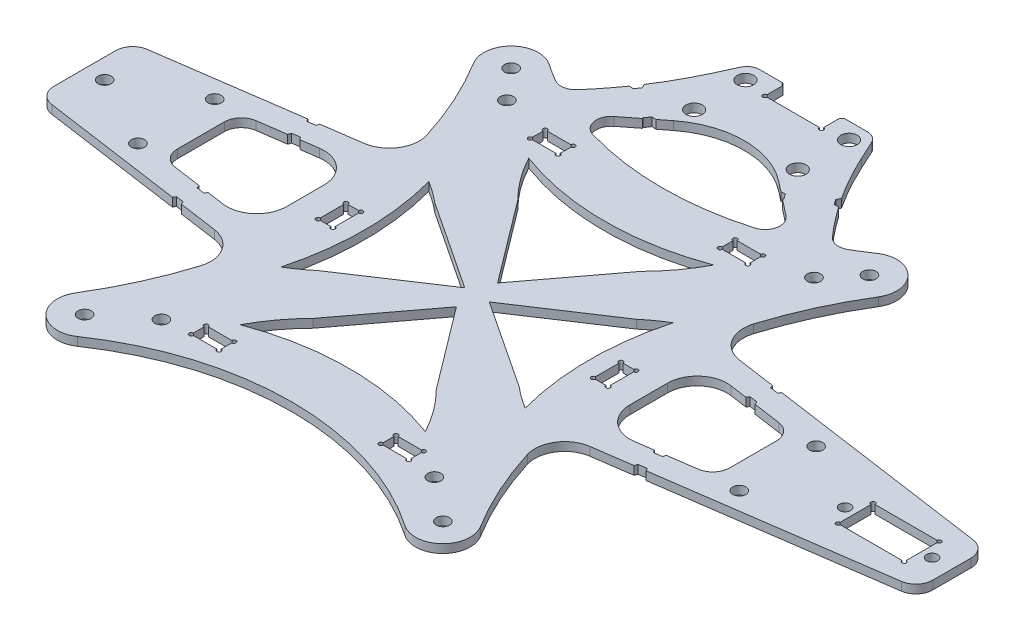
from build123d import *

# Parameters (mm, degrees)
SKETCH_1_R             = 1.55
SKETCH_1_R_2           = 1.3
SKETCH_1_W             = 6.5
SKETCH_1_H             = 3.5
SKETCH_1_W_2           = 3.5
SKETCH_1_H_2           = 6.5
SKETCH_1_W_3           = 15.5
SKETCH_1_H_3           = 8.2
EXTRUDE_1_DEPTH        = 2
FILLET_1_R             = 4
FILLET_2_R             = 7
SKETCH_4648_R          = 1.925
SKETCH_4648_R_2        = 1.55
EXTRUDE_2_DEPTH        = 2
CUT_EXTRUDE_7046_DEPTH = 137.476045095
SKETCH_10_R            = 0.5
CUT_EXTRUDE_7599_DEPTH = 137.476045095
FILLET_6_R             = 3.5


with BuildPart() as part:
    # 草图1 → 凸台-拉伸1 (new body)
    with BuildSketch(Plane(origin=(0, 0, 0), x_dir=(1, 0, 0), z_dir=(0, 1, 0))):
        with BuildLine():
            Line((111.35, 7.930343955), (111.35, -7.930343955))
            Line((111.35, -7.930343955), (36.25, -18.63611351))
            ThreePointArc((36.25, -18.63611351), (40.660213256, -33.120367866), (47.457481216, -46.649623332))
            ThreePointArc((47.457481216, -46.649623332), (46.417405741, -54.63634032), (38.389751701, -55.289161773))
            ThreePointArc((38.389751701, -55.289161773), (0, -43.436211003), (-38.389751701, -55.289161773))
            ThreePointArc((-38.389751701, -55.289161773), (-46.417405741, -54.63634032), (-47.457481216, -46.649623332))
            ThreePointArc((-47.457481216, -46.649623332), (-40.660213256, -33.120367866), (-36.25, -18.63611351))
            Line((-36.25, -18.63611351), (-91.953, -10.695454635))
            Line((-91.953, -10.695454635), (-91.953, 10.695454635))
            Line((-91.953, 10.695454635), (-36.25, 18.63611351))
            ThreePointArc((-36.25, 18.63611351), (-40.660213256, 33.120367866), (-47.457481216, 46.649623332))
            ThreePointArc((-47.457481216, 46.649623332), (-46.417405741, 54.63634032), (-38.389751701, 55.289161773))
            ThreePointArc((-38.389751701, 55.289161773), (0, 43.436211003), (38.389751701, 55.289161773))
            ThreePointArc((38.389751701, 55.289161773), (46.417405741, 54.63634032), (47.457481216, 46.649623332))
            ThreePointArc((47.457481216, 46.649623332), (40.660213256, 33.120367866), (36.25, 18.63611351))
            Line((36.25, 18.63611351), (111.35, 7.930343955))
        make_face()
        with Locations(Location((-36, 43, 0), (0, 0, 270))):
            Circle(SKETCH_1_R, mode=Mode.SUBTRACT)
        with Locations(Location((-32, -42, 0), (0, 0, 270))):
            Circle(SKETCH_1_R, mode=Mode.SUBTRACT)
        with Locations(Location((32, -42, 0), (0, 0, 90))):
            Circle(SKETCH_1_R, mode=Mode.SUBTRACT)
        with Locations(Location((36, 43, 0), (0, 0, 90))):
            Circle(SKETCH_1_R, mode=Mode.SUBTRACT)
        with Locations(Location((42, 50, 0), (0, 0, 270))):
            Circle(SKETCH_1_R, mode=Mode.SUBTRACT)
        with Locations(Location((42, -50, 0), (0, 0, 90))):
            Circle(SKETCH_1_R, mode=Mode.SUBTRACT)
        with Locations(Location((-42, -50, 0), (0, 0, 270))):
            Circle(SKETCH_1_R, mode=Mode.SUBTRACT)
        with Locations(Location((-42, 50, 0), (0, 0, 90))):
            Circle(SKETCH_1_R, mode=Mode.SUBTRACT)
        with Locations(Location((106.7, 0, 0), (0, 0, 270))):
            Circle(SKETCH_1_R_2, mode=Mode.SUBTRACT)
        with Locations(Location((86.3, 0, 0), (0, 0, 270))):
            Circle(SKETCH_1_R_2, mode=Mode.SUBTRACT)
        with Locations(Location((70.5, 9, 0), (0, 0, 270))):
            Circle(SKETCH_1_R, mode=Mode.SUBTRACT)
        with Locations(Location((70.5, -9, 0), (0, 0, 90))):
            Circle(SKETCH_1_R, mode=Mode.SUBTRACT)
        with Locations(Location((-70.5, -9, 0), (0, 0, 270))):
            Circle(SKETCH_1_R, mode=Mode.SUBTRACT)
        with Locations(Location((-70.5, 9, 0), (0, 0, 90))):
            Circle(SKETCH_1_R, mode=Mode.SUBTRACT)
        with Locations(Location((-87.3, 0, 0), (0, 0, 270))):
            Circle(SKETCH_1_R, mode=Mode.SUBTRACT)
        with Locations((-22.25, 39.75)):
            Rectangle(SKETCH_1_W, SKETCH_1_H, mode=Mode.SUBTRACT)
        with Locations((-32.25, 0)):
            Rectangle(SKETCH_1_W_2, SKETCH_1_H_2, mode=Mode.SUBTRACT)
        with Locations((-22.25, -39.75)):
            Rectangle(SKETCH_1_W, SKETCH_1_H, mode=Mode.SUBTRACT)
        with Locations((22.25, 39.75)):
            Rectangle(SKETCH_1_W, SKETCH_1_H, mode=Mode.SUBTRACT)
        with Locations((22.25, -39.75)):
            Rectangle(SKETCH_1_W, SKETCH_1_H, mode=Mode.SUBTRACT)
        with Locations((32.25, 0)):
            Rectangle(SKETCH_1_W_2, SKETCH_1_H_2, mode=Mode.SUBTRACT)
        with Locations((96.5, 0)):
            Rectangle(SKETCH_1_W_3, SKETCH_1_H_3, mode=Mode.SUBTRACT)
        with BuildLine():
            Line((14.429581723, 23.978041684), (0, 4.824748809))
            Line((0, 4.824748809), (-14.429581723, 23.978041684))
            ThreePointArc((-14.429581723, 23.978041684), (-18.426289548, 28.624383111), (-21.683554993, 33.815951652))
            ThreePointArc((-21.683554993, 33.815951652), (0, 29.906632618), (21.683554993, 33.815951652))
            ThreePointArc((21.683554993, 33.815951652), (18.426289548, 28.624383111), (14.429581723, 23.978041684))
        make_face(mode=Mode.SUBTRACT)
        with BuildLine():
            Line((23.625656004, -13.733041529), (2.87566363, 0))
            Line((2.87566363, 0), (23.625656004, 13.733041529))
            ThreePointArc((23.625656004, 13.733041529), (26.070594521, 15.638611076), (28.652877812, 17.35346753))
            ThreePointArc((28.652877812, 17.35346753), (26.34962019, 0), (28.652877812, -17.35346753))
            ThreePointArc((28.652877812, -17.35346753), (26.069043855, -15.640764287), (23.625656004, -13.733041529))
        make_face(mode=Mode.SUBTRACT)
        Polygon((-64.75, -8.96722955), (-64.75, 8.96722955), (-40.25, 12.459790856), (-40.25, -12.459790856), align=None, mode=Mode.SUBTRACT)
        Polygon((64.75, 8.96722955), (40.25, 12.459790856), (40.25, -12.459790856), (64.75, -8.96722955), align=None, mode=Mode.SUBTRACT)
        with BuildLine():
            Line((-23.625656004, 13.733041529), (-2.87566363, 0))
            Line((-2.87566363, 0), (-23.625656004, -13.733041529))
            ThreePointArc((-23.625656004, -13.733041529), (-26.069043855, -15.640764287), (-28.652877812, -17.35346753))
            ThreePointArc((-28.652877812, -17.35346753), (-26.34962019, 0), (-28.652877812, 17.35346753))
            ThreePointArc((-28.652877812, 17.35346753), (-26.070594521, 15.638611076), (-23.625656004, 13.733041529))
        make_face(mode=Mode.SUBTRACT)
        with BuildLine():
            Line((-14.429581723, -23.978041684), (0, -4.824748809))
            Line((0, -4.824748809), (14.429581723, -23.978041684))
            ThreePointArc((14.429581723, -23.978041684), (18.426289548, -28.624383111), (21.683554993, -33.815951652))
            ThreePointArc((21.683554993, -33.815951652), (0, -29.906632618), (-21.683554993, -33.815951652))
            ThreePointArc((-21.683554993, -33.815951652), (-18.426289548, -28.624383111), (-14.429581723, -23.978041684))
        make_face(mode=Mode.SUBTRACT)
    extrude(amount=EXTRUDE_1_DEPTH)

    # 圆角1
    fillet_1_edges = [part.edges().sort_by_distance(p)[0] for p in [
        (-64.75, 1, -8.96722955),
        (-64.75, 1, 8.96722955),
        (64.75, 1, 8.96722955),
        (64.75, 1, -8.96722955),
        (111.35, 1, -7.930343955),
        (111.35, 1, 7.930343955),
        (-91.953, 1, 10.695454635),
        (-91.953, 1, -10.695454635),
    ]]
    fillet(fillet_1_edges, radius=FILLET_1_R)

    # 圆角2
    fillet_2_edges = [part.edges().sort_by_distance(p)[0] for p in [
        (-40.25, 1, -12.459790856),
        (-40.25, 1, 12.459790856),
        (40.25, 1, -12.459790856),
        (40.25, 1, 12.459790856),
        (-36.25, 1, -18.63611351),
        (36.25, 1, -18.63611351),
        (36.25, 1, 18.63611351),
        (-36.25, 1, 18.63611351),
    ]]
    fillet(fillet_2_edges, radius=FILLET_2_R)

    # Sketch 4648 → 凸台-拉伸2 (add)
    with BuildSketch(Plane(origin=(0, 0, 0), x_dir=(1, 0, 0), z_dir=(0, 1, 0))):
        with BuildLine():
            Line((30.40246304, 52.857720294), (32.037278544, 51.028700347))
            ThreePointArc((32.037278544, 51.028700347), (34.725061467, 48.527352956), (37.824815498, 46.559501145))
            ThreePointArc((37.824815498, 46.559501145), (38.771413552, 40.115686057), (32.370509151, 41.318692124))
            ThreePointArc((32.370509151, 41.318692124), (31.135199663, 43.325028618), (29.464750167, 44.986646546))
            Line((29.464750167, 44.986646546), (12.33593628, 58.408952508))
            ThreePointArc((12.33593628, 58.408952508), (0, 62.666504283), (-12.33593628, 58.408952508))
            Line((-12.33593628, 58.408952508), (-29.464750167, 44.986646546))
            ThreePointArc((-29.464750167, 44.986646546), (-31.135199663, 43.325028618), (-32.370509151, 41.318692124))
            ThreePointArc((-32.370509151, 41.318692124), (-38.771413552, 40.115686057), (-37.824815498, 46.559501145))
            ThreePointArc((-37.824815498, 46.559501145), (-34.725061467, 48.527352956), (-32.037278544, 51.028700347))
            Line((-32.037278544, 51.028700347), (-30.40246304, 52.857720294))
            ThreePointArc((-30.40246304, 52.857720294), (-23.129287971, 62.333031959), (-17.34800881, 72.785659285))
            Line((-17.34800881, 72.785659285), (-15.34970392, 77.137234504))
            ThreePointArc((-15.34970392, 77.137234504), (-14.242702771, 78.410741128), (-12.62341972, 78.885286238))
            Line((-12.62341972, 78.885286238), (-6.65, 78.885286238))
            Line((-6.65, 78.885286238), (-6.65, 74.135286238))
            Line((-6.65, 74.135286238), (-0.15, 74.135286238))
            Line((-0.15, 74.135286238), (0.15, 74.135286238))
            Line((0.15, 74.135286238), (6.65, 74.135286238))
            Line((6.65, 74.135286238), (6.65, 78.885286238))
            Line((6.65, 78.885286238), (12.62341972, 78.885286238))
            ThreePointArc((12.62341972, 78.885286238), (14.242702771, 78.410741128), (15.34970392, 77.137234504))
            Line((15.34970392, 77.137234504), (17.34800881, 72.785659285))
            ThreePointArc((17.34800881, 72.785659285), (23.129287971, 62.333031959), (30.40246304, 52.857720294))
        make_face()
        with Locations(Location((-12.15, 75.08, 0), (0, 0, 270))):
            Circle(SKETCH_4648_R, mode=Mode.SUBTRACT)
        with Locations(Location((-12.15, 63.05, 0), (0, 0, 270))):
            Circle(SKETCH_4648_R, mode=Mode.SUBTRACT)
        with Locations(Location((12.15, 63.05, 0), (0, 0, 270))):
            Circle(SKETCH_4648_R, mode=Mode.SUBTRACT)
        with Locations(Location((12.15, 75.08, 0), (0, 0, 270))):
            Circle(SKETCH_4648_R, mode=Mode.SUBTRACT)
        with Locations(Location((-36, 43, 0), (0, 0, 270))):
            Circle(SKETCH_4648_R_2, mode=Mode.SUBTRACT)
        with Locations(Location((36, 43, 0), (0, 0, 90))):
            Circle(SKETCH_4648_R_2, mode=Mode.SUBTRACT)
    extrude(amount=EXTRUDE_2_DEPTH)

    # Sketch 6071 → Cut-Extrude 7046 (cut, through all)
    with BuildSketch(Plane(origin=(0, 0, 0), x_dir=(1, 0, 0), z_dir=(0, 1, 0))):
        Polygon((54.567863287, 11.07530028), (52.693017281, 11.342566183), (52.301218463, 10.741847212), (54.776197291, 10.389030261), align=None)
        Polygon((53.292806097, 15.550030191), (53.084472093, 16.23630021), (55.559450921, 15.883483259), (55.167652103, 15.282764288), align=None)
        Polygon((-55.167652103, 15.282764288), (-53.292806097, 15.550030191), (-53.084472093, 16.23630021), (-55.559450921, 15.883483259), align=None)
        Polygon((-52.693017281, 11.342566183), (-52.301218463, 10.741847212), (-54.776197291, 10.389030261), (-54.567863287, 11.07530028), align=None)
        Polygon((-54.567863287, -11.07530028), (-52.693017281, -11.342566183), (-52.301218463, -10.741847212), (-54.776197291, -10.389030261), align=None)
        Polygon((-53.292806097, -15.550030191), (-53.084472093, -16.23630021), (-55.559450921, -15.883483259), (-55.167652103, -15.282764288), align=None)
        Polygon((55.167652103, -15.282764288), (53.292806097, -15.550030191), (53.084472093, -16.23630021), (55.559450921, -15.883483259), align=None)
        Polygon((52.693017281, -11.342566183), (52.301218463, -10.741847212), (54.776197291, -10.389030261), (54.567863287, -11.07530028), align=None)
        with BuildLine():
            Line((23.129287971, 62.333031959), (22.69415093, 61.432667724))
            Line((22.69415093, 61.432667724), (23.53173116, 60.192810938))
            Line((23.53173116, 60.192810938), (24.53173116, 60.263453958))
            ThreePointArc((24.53173116, 60.263453958), (23.822424783, 61.292764331), (23.129287971, 62.333031959))
        make_face()
        Polygon((16.058132481, 54.522038927), (14.656333074, 56.590666902), (15.656333074, 56.662758484), (16.49569934, 55.424110122), align=None)
        Polygon((-16.49569934, 55.424110122), (-16.058132481, 54.522038927), (-14.656333074, 56.590666902), (-15.656333074, 56.662758484), align=None)
        with BuildLine():
            Line((-23.53173116, 60.192810938), (-24.53173116, 60.263453958))
            ThreePointArc((-24.53173116, 60.263453958), (-23.822424783, 61.292764331), (-23.129287971, 62.333031959))
            Line((-23.129287971, 62.333031959), (-22.69415093, 61.432667724))
            Line((-22.69415093, 61.432667724), (-23.53173116, 60.192810938))
        make_face()
    extrude(amount=CUT_EXTRUDE_7046_DEPTH, mode=Mode.SUBTRACT)

    # 草图10 → Cut-Extrude 7599 (cut, through all)
    with BuildSketch(Plane(origin=(0, 0, 0), x_dir=(1, 0, 0), z_dir=(0, 1, 0))):
        with Locations((-25.5, 41.5)):
            Circle(SKETCH_10_R)
        with Locations((-19, 41.5)):
            Circle(SKETCH_10_R)
        with Locations((-25.5, 38)):
            Circle(SKETCH_10_R)
        with Locations((-19, 38)):
            Circle(SKETCH_10_R)
        with Locations((-34, 3.25)):
            Circle(SKETCH_10_R)
        with Locations((-30.5, 3.25)):
            Circle(SKETCH_10_R)
        with Locations((-34, -3.25)):
            Circle(SKETCH_10_R)
        with Locations((-30.5, -3.25)):
            Circle(SKETCH_10_R)
        with Locations((-25.5, -38)):
            Circle(SKETCH_10_R)
        with Locations((-19, -38)):
            Circle(SKETCH_10_R)
        with Locations((-25.5, -41.5)):
            Circle(SKETCH_10_R)
        with Locations((-19, -41.5)):
            Circle(SKETCH_10_R)
        with Locations((19, -41.5)):
            Circle(SKETCH_10_R)
        with Locations((25.5, -41.5)):
            Circle(SKETCH_10_R)
        with Locations((19, -38)):
            Circle(SKETCH_10_R)
        with Locations((25.5, -38)):
            Circle(SKETCH_10_R)
        with Locations((30.5, -3.25)):
            Circle(SKETCH_10_R)
        with Locations((34, -3.25)):
            Circle(SKETCH_10_R)
        with Locations((30.5, 3.25)):
            Circle(SKETCH_10_R)
        with Locations((34, 3.25)):
            Circle(SKETCH_10_R)
        with Locations((19, 38)):
            Circle(SKETCH_10_R)
        with Locations((25.5, 38)):
            Circle(SKETCH_10_R)
        with Locations((19, 41.5)):
            Circle(SKETCH_10_R)
        with Locations((25.5, 41.5)):
            Circle(SKETCH_10_R)
        with Locations((88.75, 4.1)):
            Circle(SKETCH_10_R)
        with Locations((104.25, 4.1)):
            Circle(SKETCH_10_R)
        with Locations((88.75, -4.1)):
            Circle(SKETCH_10_R)
        with Locations((104.25, -4.1)):
            Circle(SKETCH_10_R)
        with Locations((-6.65, 74.135286238)):
            Circle(SKETCH_10_R)
        with Locations((6.65, 74.135286238)):
            Circle(SKETCH_10_R)
        with Locations((-6.65, 78.885286238)):
            Circle(SKETCH_10_R)
        with Locations((6.65, 78.885286238)):
            Circle(SKETCH_10_R)
    extrude(amount=CUT_EXTRUDE_7599_DEPTH, mode=Mode.SUBTRACT)

    # 圆角6
    fillet_6_edges = [part.edges().sort_by_distance(p)[0] for p in [
        (31.785860953, 1, -51.309984558),
        (25.248934055, 1, -48.290201252),
        (-31.785860953, 1, -51.309984558),
        (-25.248934055, 1, -48.290201252),
    ]]
    fillet(fillet_6_edges, radius=FILLET_6_R)


solid = part.part
